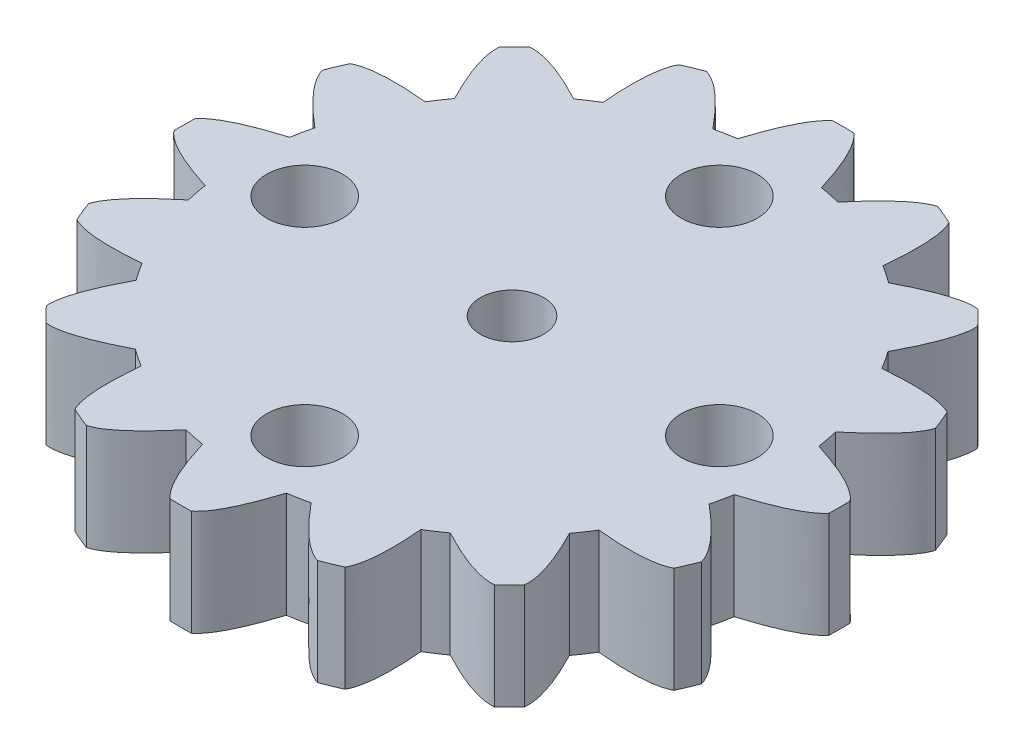
from build123d import *

# Parameters (mm, degrees)
SKETCH1_R           = 12.732395447
BOSS_EXTRUDE4_DEPTH = 5
CIRPATTERN6_COUNT   = 16
SKETCH2_R           = 1.5
CUT_EXTRUDE1_DEPTH  = 10
SKETCH5_R           = 1.8
CUT_EXTRUDE2_DEPTH  = 10
CIRPATTERN7_COUNT   = 4


with BuildPart() as part:
    # Sketch1 → Boss-Extrude4 (new body)
    with BuildSketch(Plane(origin=(0, 0, 0), x_dir=(1, 0, 0), z_dir=(0, 1, 0))):
        Circle(SKETCH1_R)
        with BuildLine():
            ThreePointArc((11.422555102, 10.588944735), (11.251101314, 10.770944011), (11.076748025, 10.950167526))
            ThreePointArc((11.076748025, 10.950167526), (10.899540167, 11.126569094), (10.719523409, 11.300103253))
            add(Edge.make_bspline(
                [(10.719523409, 11.300103253), (9.768180921, 11.408474051), (7.542984157, 10.257547652)],
                knots=[0.625515525, 0.625515525, 0.625515525, 1, 1, 1], degree=2))
            ThreePointArc((7.542984157, 10.257547652), (9.054751485, 8.951277527), (10.34356078, 7.424597242))
            add(Edge.make_bspline(
                [(10.34356078, 7.424597242), (11.519985079, 9.636419587), (11.422555102, 10.588944735)],
                knots=[0, 0, 0, 0.374484475, 0.374484475, 0.374484475], degree=2))
        make_face()
    boss_extrude4 = extrude(amount=BOSS_EXTRUDE4_DEPTH)

    # CirPattern6: Boss-Extrude4 ×16 about axis
    cirpattern6_axis = Axis((0, 0, 0), (0, -1, 0))
    for i in range(1, CIRPATTERN6_COUNT):
        add(boss_extrude4.rotate(cirpattern6_axis, i * 360 / CIRPATTERN6_COUNT))

    # Sketch2 → Cut-Extrude1 (cut)
    with BuildSketch(Plane(origin=(0, 5, 0), x_dir=(1, 0, 0), z_dir=(0, 1, 0))):
        with Locations(Location((0, 0, 0), (0, 0, 270))):
            Circle(SKETCH2_R)
    extrude(amount=-CUT_EXTRUDE1_DEPTH, mode=Mode.SUBTRACT)

    # Sketch5 → Cut-Extrude2 (cut)
    with BuildSketch(Plane(origin=(0, 5, 0), x_dir=(1, 0, 0), z_dir=(0, 1, 0))):
        with Locations(Location((9.8, 0, 0), (0, 0, 270))):
            Circle(SKETCH5_R)
    cut_extrude2 = extrude(amount=-CUT_EXTRUDE2_DEPTH, mode=Mode.SUBTRACT)

    # CirPattern7: Cut-Extrude2 ×4 about axis
    cirpattern7_axis = Axis((0, 0, 0), (0, 1, 0))
    for i in range(1, CIRPATTERN7_COUNT):
        add(cut_extrude2.rotate(cirpattern7_axis, i * 360 / CIRPATTERN7_COUNT), mode=Mode.SUBTRACT)


solid = part.part
